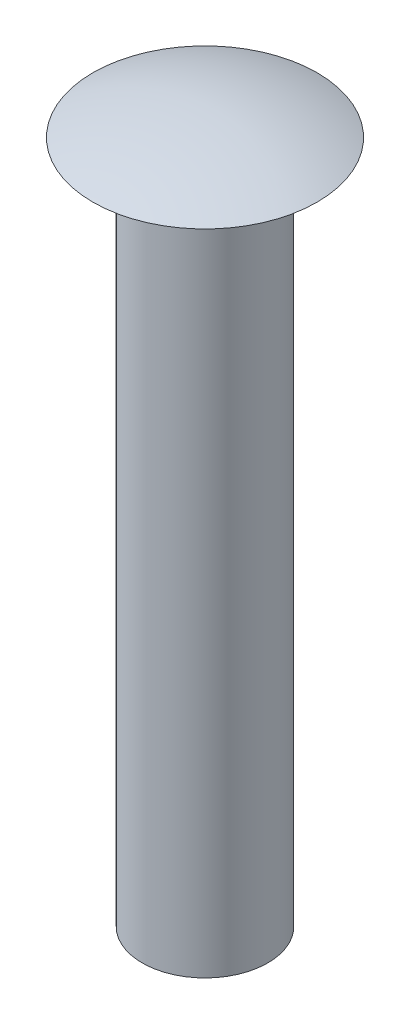
from build123d import *

# Parameters (mm, degrees)
SKETCH1_R           = 1.75
BOSS_EXTRUDE1_DEPTH = 19.05


with BuildPart() as part:
    # Sketch1 → Boss-Extrude1 (new body)
    with BuildSketch(Plane(origin=(0, 0, 0), x_dir=(1, 0, 0), z_dir=(0, 1, 0))):
        with Locations(Location((0, 0, 0), (0, 0, 90))):
            Circle(SKETCH1_R)
    extrude(amount=BOSS_EXTRUDE1_DEPTH)

    # Sketch2 → Revolve1 (revolve)
    with BuildSketch(Plane.XY):
        with BuildLine():
            Line((0, 19.05), (0, 19.685))
            ThreePointArc((0, 19.685), (1.5944216, 19.524594488), (3.125, 19.05))
            Line((3.125, 19.05), (0, 19.05))
        make_face()
    revolve(axis=Axis((0, 19.05, 0), (0, 1, 0)))


solid = part.part
